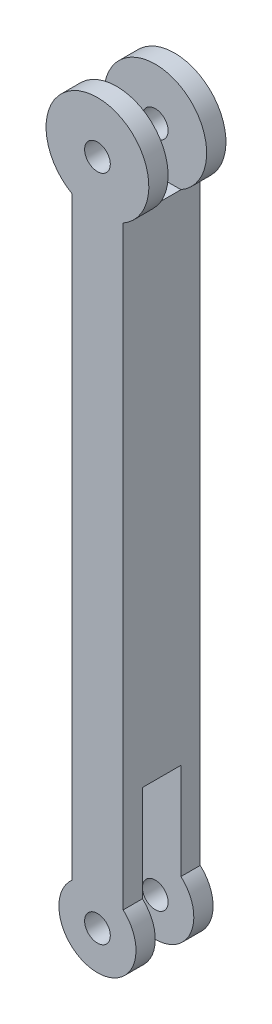
from build123d import *

# Parameters (mm, degrees)
SALIENTE_EXTRUIR1_DEPTH = 12
CROQUIS3_R              = 2
CORTAR_EXTRUIR1_DEPTH   = 63.903673209
CROQUIS4_W              = 30
CROQUIS4_H              = 6
CORTAR_EXTRUIR2_DEPTH   = 14
CROQUIS5_W              = 8
CROQUIS5_H              = 6
CORTAR_EXTRUIR3_DEPTH   = 15
CROQUIS8_W              = 30
CROQUIS8_H              = 6
CORTAR_EXTRUIR6_DEPTH   = 39


with BuildPart() as part:
    # Croquis1 → Saliente-Extruir1 (new body)
    with BuildSketch(Plane.XY):
        with BuildLine():
            Line((-4, 46.299830407), (-4, -46.299830407))
            ThreePointArc((-4, -46.299830407), (0, -56.771966362), (4, -46.299830407))
            Line((4, -46.299830407), (4, 46.299830407))
            ThreePointArc((4, 46.299830407), (0, 61.228033638), (-4, 46.299830407))
        make_face()
    extrude(amount=SALIENTE_EXTRUIR1_DEPTH)

    # Croquis3 → Cortar-Extruir1 (cut, through all)
    with BuildSketch(Plane.XY.offset(12)):
        with Locations((0, 53.228033638)):
            Circle(CROQUIS3_R)
        with Locations((0, -50.771966362)):
            Circle(CROQUIS3_R)
    extrude(amount=-CORTAR_EXTRUIR1_DEPTH, mode=Mode.SUBTRACT)

    # Croquis4 → Cortar-Extruir2 (cut)
    with BuildSketch(Plane(origin=(0, -46.299830407, 0), x_dir=(1, 0, 0), z_dir=(0, 1, 0))):
        with Locations((0, -6)):
            Rectangle(CROQUIS4_W, CROQUIS4_H)
    extrude(amount=-CORTAR_EXTRUIR2_DEPTH, mode=Mode.SUBTRACT)

    # Croquis5 → Cortar-Extruir3 (cut)
    with BuildSketch(Plane.XZ.offset(46.299830407)):
        with Locations((0, 6)):
            Rectangle(CROQUIS5_W, CROQUIS5_H)
    extrude(amount=-CORTAR_EXTRUIR3_DEPTH, mode=Mode.SUBTRACT)

    # Croquis8 → Cortar-Extruir6 (cut)
    with BuildSketch(Plane(origin=(0, 46.299830407, 0), x_dir=(1, 0, 0), z_dir=(0, 1, 0))):
        with Locations((0, -6)):
            Rectangle(CROQUIS8_W, CROQUIS8_H)
    extrude(amount=CORTAR_EXTRUIR6_DEPTH, mode=Mode.SUBTRACT)


solid = part.part
